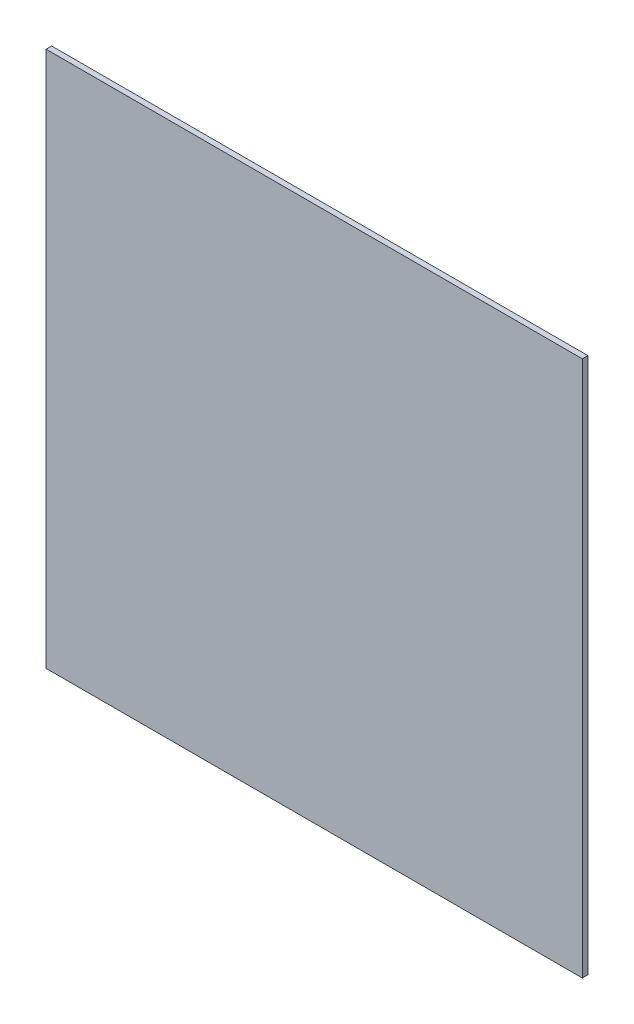
from build123d import *

# Parameters (mm, degrees)
SKETCH1_W           = 304.8
SKETCH1_H           = 304.8
BOSS_EXTRUDE1_DEPTH = 3.175


with BuildPart() as part:
    # Sketch1 → Boss-Extrude1 (new body)
    with BuildSketch(Plane.XY):
        with Locations((152.4, 152.4)):
            Rectangle(SKETCH1_W, SKETCH1_H)
    extrude(amount=BOSS_EXTRUDE1_DEPTH)


solid = part.part
